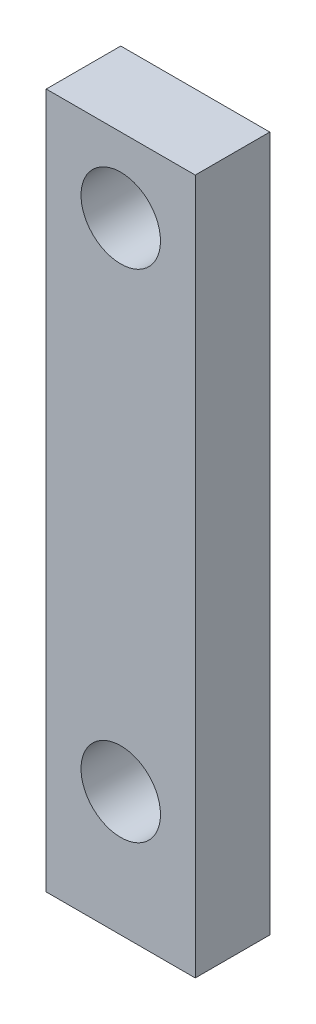
from build123d import *

# Parameters (mm, degrees)
SKICA1_W                = 6
SKICA1_H                = 28
SKICA1_R                = 1.6
P_IDAT_VYSUNUT_M1_DEPTH = 3


with BuildPart() as part:
    # Skica1 → Přidat vysunutím1 (new body)
    with BuildSketch(Plane.XY):
        with Locations((-7.524287798, 68.3)):
            Rectangle(SKICA1_W, SKICA1_H)
        with Locations((-7.524287798, 59.3)):
            Circle(SKICA1_R, mode=Mode.SUBTRACT)
        with Locations((-7.524287798, 79.3)):
            Circle(SKICA1_R, mode=Mode.SUBTRACT)
    extrude(amount=P_IDAT_VYSUNUT_M1_DEPTH)


solid = part.part
